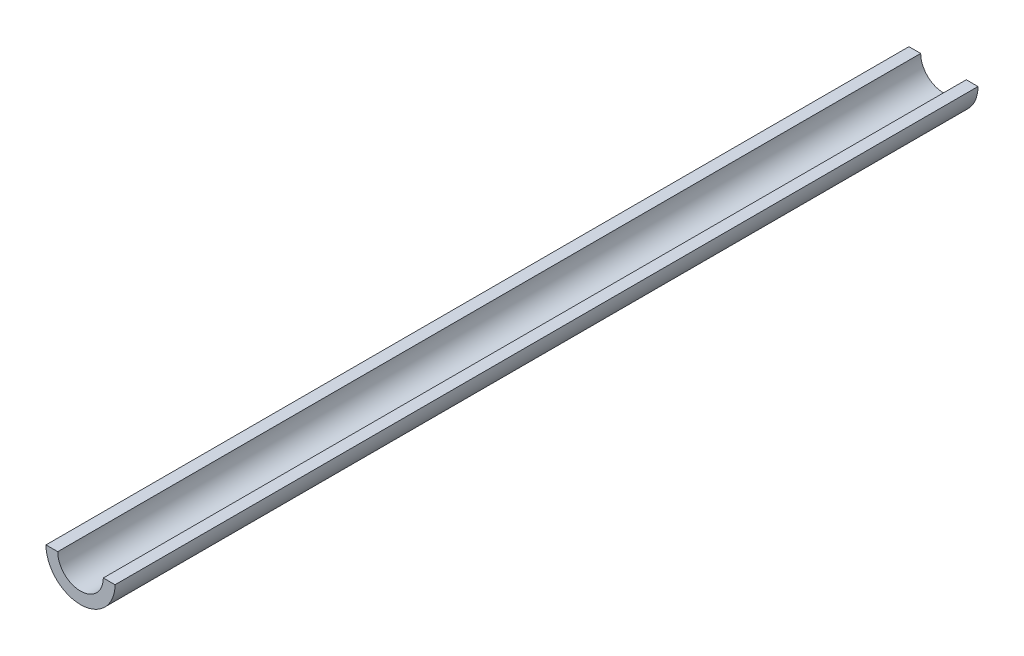
from build123d import *

# Parameters (mm, degrees)
EXTRUDE_1_DEPTH = 125


with BuildPart() as part:
    # 草图1 → 凸台-拉伸1 (new, symmetric)
    with BuildSketch(Plane.XY):
        with BuildLine():
            Line((-10, 0), (-6.6, 0))
            ThreePointArc((-6.6, 0), (0, -6.6), (6.6, 0))
            Line((6.6, 0), (10, 0))
            ThreePointArc((10, 0), (0, -10), (-10, 0))
        make_face()
    extrude(amount=EXTRUDE_1_DEPTH, both=True)


solid = part.part
